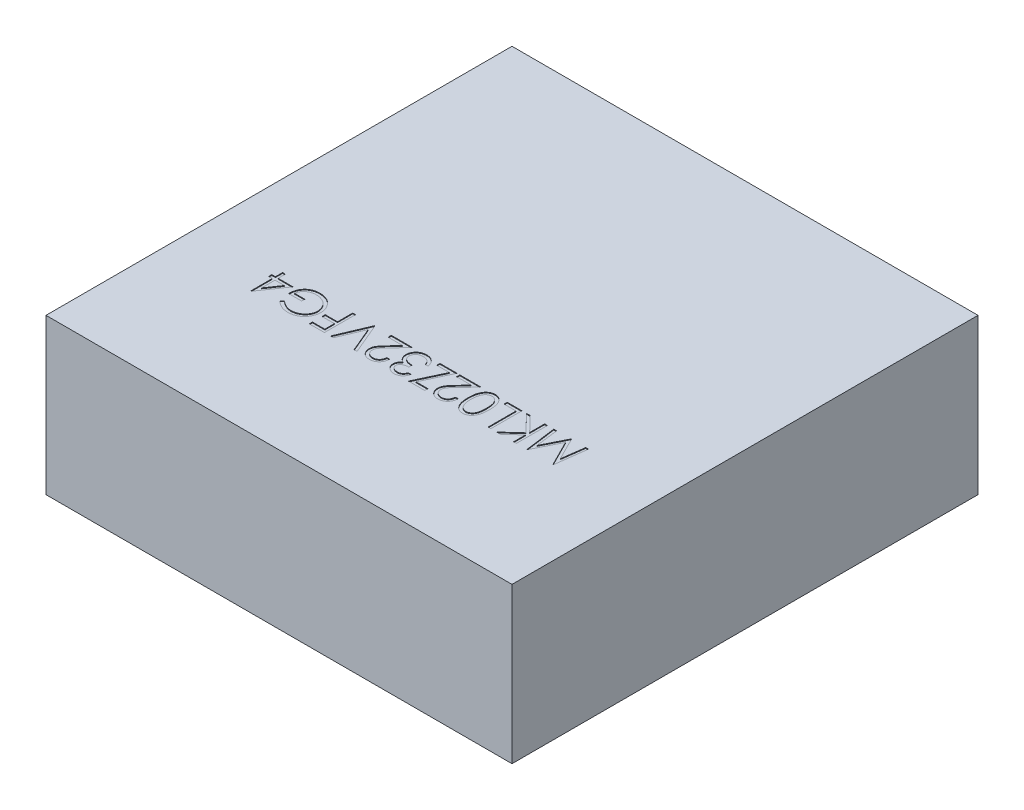
from build123d import *

# Parameters (mm, degrees)
BASES_W          = 3
BASES_H          = 3
BASE_DEPTH       = 1
PARTNUMBER_DEPTH = 0.005


with BuildPart() as part:
    # BaseS → Base (new body)
    with BuildSketch(Plane(origin=(0, 0, 0), x_dir=(1, 0, 0), z_dir=(0, 1, 0))):
        Rectangle(BASES_W, BASES_H)
    extrude(amount=BASE_DEPTH)

    # PartNumberS → PartNumber (cut)
    # profile 1 of 12: a face of its own
    with BuildSketch(Plane(origin=(0, 1, 0), x_dir=(1, 0, 0), z_dir=(0, 1, 0))):
        Polygon((0.992307692, -0.5), (0.965905449, -0.7), (0.963341346, -0.7), (0.880769231, -0.535897436), (0.798397436, -0.7), (0.795793269, -0.7), (0.769230769, -0.5), (0.787259615, -0.5), (0.806410256, -0.643910256), (0.878605769, -0.5), (0.882652244, -0.5), (0.955128205, -0.644230769), (0.974238782, -0.5), align=None)
    # profile 2 of 12: a face of its own
    with BuildSketch(Plane(origin=(0, 1, 0), x_dir=(1, 0, 0), z_dir=(0, 1, 0))):
        Polygon((0.728205128, -0.7), (0.71025641, -0.7), (0.71025641, -0.623838141), (0.626883013, -0.7), (0.601282051, -0.7), (0.699559295, -0.61025641), (0.593589744, -0.5), (0.617508013, -0.5), (0.71025641, -0.596514423), (0.71025641, -0.5), (0.728205128, -0.5), align=None)
    # profile 3 of 12: a face of its own
    with BuildSketch(Plane(origin=(0, 1, 0), x_dir=(1, 0, 0), z_dir=(0, 1, 0))):
        Polygon((0.564102564, -0.7), (0.546153846, -0.7), (0.546153846, -0.520512821), (0.469230769, -0.520512821), (0.469230769, -0.5), (0.564102564, -0.5), align=None)
    # profile 4 of 12: a face of its own
    with BuildSketch(Plane(origin=(0, 1, 0), x_dir=(1, 0, 0), z_dir=(0, 1, 0))):
        with BuildLine():
            add(Edge.make_bspline(
                [(0.453846154, -0.599919872), (0.45382741, -0.603125437), (0.453791, -0.609352293), (0.453385947, -0.618425701), (0.45271307, -0.626937718), (0.451790935, -0.63488875), (0.450668765, -0.642280851), (0.449170735, -0.649094264), (0.447467153, -0.655360534), (0.445492704, -0.661100057), (0.443264911, -0.666390288), (0.440839812, -0.671328601), (0.438122833, -0.675909097), (0.4352634, -0.680199264), (0.432161436, -0.684155927), (0.42882773, -0.687761304), (0.425291645, -0.691071266), (0.421536448, -0.694031384), (0.417597932, -0.696610732), (0.413592604, -0.698948853), (0.409406222, -0.700798371), (0.405142046, -0.702379922), (0.400765722, -0.703632724), (0.396275342, -0.704504146), (0.391666876, -0.705049326), (0.388556562, -0.705101663), (0.386979167, -0.705128205)],
                knots=[0, 0, 0, 0, 1.64625301, 3.197870201, 4.6634513, 6.030635694, 7.308242971, 8.501545196, 9.611429483, 10.641742253, 11.616230371, 12.55791849, 13.464870342, 14.34944951, 15.20427819, 16.044004467, 16.869007726, 17.689551165, 18.496129964, 19.285613293, 20.0683943, 20.843080271, 21.620342827, 22.403213977, 23.190190624, 24, 24, 24, 24], degree=3))
            add(Edge.make_bspline(
                [(0.386979167, -0.705128205), (0.385387797, -0.705106134), (0.38222153, -0.705062219), (0.377557236, -0.704444098), (0.372974186, -0.703646272), (0.368541914, -0.702366689), (0.364176614, -0.700835502), (0.359986842, -0.698815126), (0.355824678, -0.696617809), (0.351879203, -0.693937268), (0.348032533, -0.690974829), (0.344426682, -0.687611703), (0.340969474, -0.683940966), (0.337791486, -0.679880749), (0.334756515, -0.675493306), (0.331979772, -0.67074186), (0.329403504, -0.66563694), (0.326979285, -0.66020221), (0.32485937, -0.654292502), (0.322974596, -0.647944676), (0.321429704, -0.641101249), (0.320152106, -0.633800343), (0.319160447, -0.62600579), (0.318438734, -0.617733383), (0.318057372, -0.608977945), (0.317985566, -0.60299178), (0.317948718, -0.599919872)],
                knots=[0, 0, 0, 0, 0.810910589, 1.61342667, 2.396193133, 3.181089899, 3.963115317, 4.752255436, 5.550715454, 6.36105385, 7.181178335, 8.024612154, 8.872680183, 9.750181803, 10.651284446, 11.591556747, 12.554036451, 13.566402641, 14.62422919, 15.753422176, 16.94128843, 18.199818041, 19.531985927, 20.947085226, 22.433341622, 24, 24, 24, 24], degree=3))
            add(Edge.make_bspline(
                [(0.317948718, -0.599919872), (0.317986423, -0.596861401), (0.318060053, -0.590888756), (0.318430055, -0.582172145), (0.319179794, -0.573944878), (0.32009359, -0.566195034), (0.321411105, -0.558932745), (0.322877893, -0.552119008), (0.324748864, -0.545817847), (0.326818495, -0.539958796), (0.329208983, -0.534547089), (0.331765848, -0.529463239), (0.334584042, -0.524738759), (0.337560777, -0.520323507), (0.34079893, -0.516298111), (0.344209352, -0.512586312), (0.347850186, -0.509217343), (0.351716657, -0.506219926), (0.355699424, -0.503519192), (0.3598624, -0.501243526), (0.364108132, -0.49925961), (0.368480783, -0.497664773), (0.372952469, -0.496404048), (0.377539293, -0.495545817), (0.382222154, -0.494940871), (0.385388005, -0.4948949), (0.386979167, -0.494871795)],
                knots=[0, 0, 0, 0, 1.561431216, 3.049195289, 4.452146966, 5.778046447, 7.031138842, 8.218704273, 9.334037798, 10.384210803, 11.388620812, 12.352076869, 13.287433199, 14.19507451, 15.06813243, 15.922055533, 16.766344942, 17.596869952, 18.417486629, 19.220035357, 20.016159057, 20.807716045, 21.59340902, 22.384936649, 23.188266813, 24, 24, 24, 24], degree=3))
            add(Edge.make_bspline(
                [(0.386979167, -0.494871795), (0.388556507, -0.494898572), (0.391666713, -0.494951373), (0.396275972, -0.495493155), (0.400759842, -0.49637662), (0.405127285, -0.497576361), (0.409387239, -0.49910116), (0.413497978, -0.501040647), (0.417513774, -0.503290158), (0.421416363, -0.505849366), (0.425131138, -0.508782275), (0.428680244, -0.512025516), (0.431970786, -0.515662669), (0.435051357, -0.519635684), (0.437934516, -0.52393665), (0.440639989, -0.528552213), (0.443057704, -0.533538633), (0.445336009, -0.538857583), (0.447344353, -0.544639279), (0.449098001, -0.550927022), (0.450576487, -0.557763701), (0.451754121, -0.565149643), (0.452718866, -0.573073415), (0.453385284, -0.581547642), (0.453790797, -0.590554174), (0.453827365, -0.596741003), (0.453846154, -0.599919872)],
                knots=[0, 0, 0, 0, 0.810976328, 1.599087026, 2.383086309, 3.159618043, 3.926613167, 4.707144544, 5.494386734, 6.292609454, 7.104690378, 7.92621526, 8.762510248, 9.62398222, 10.509836085, 11.424023232, 12.373226806, 13.358118208, 14.398657954, 15.5185989, 16.713620699, 17.994156382, 19.364120462, 20.818119981, 22.365111093, 24, 24, 24, 24], degree=3))
        make_face()
        with BuildLine():
            add(Edge.make_bspline(
                [(0.435897436, -0.6), (0.435890461, -0.597328656), (0.435876923, -0.592144103), (0.4355335, -0.58462337), (0.43505549, -0.577596997), (0.434454125, -0.571067726), (0.433553497, -0.565058375), (0.432531677, -0.559543965), (0.431306074, -0.554534693), (0.42984879, -0.549986815), (0.428188889, -0.54583583), (0.426379449, -0.541971444), (0.424419435, -0.538346652), (0.422263877, -0.534974532), (0.419881894, -0.531873918), (0.417326651, -0.529030085), (0.414583291, -0.526454611), (0.410786486, -0.523398046), (0.40579838, -0.520202297), (0.399481442, -0.517453649), (0.392987642, -0.515715134), (0.388578797, -0.515494661), (0.386378205, -0.515384615)],
                knots=[0, 0, 0, 0, 1.459193451, 2.832007961, 4.111736495, 5.306635028, 6.412683014, 7.430020708, 8.369596877, 9.227877302, 10.036669781, 10.810175692, 11.557788084, 12.286326232, 12.994037279, 13.69140682, 14.37267704, 15.047194847, 16.352618509, 17.594157723, 18.799169539, 20, 20, 20, 20], degree=3))
            add(Edge.make_bspline(
                [(0.386378205, -0.515384615), (0.384164977, -0.51548111), (0.379746373, -0.515673757), (0.373256993, -0.517355101), (0.367009194, -0.520088434), (0.362078497, -0.523211202), (0.35833772, -0.526204156), (0.355656526, -0.528752995), (0.3531959, -0.531607774), (0.35086205, -0.53468769), (0.348721536, -0.538051844), (0.346775069, -0.541683988), (0.344998878, -0.545594227), (0.343986933, -0.548323927), (0.343469551, -0.549719551)],
                knots=[0, 0, 0, 0, 1.353621445, 2.702441307, 4.075953605, 5.516772412, 6.261413105, 7.007624062, 7.778524365, 8.566925914, 9.372323995, 10.217594641, 11.088702136, 12, 12, 12, 12], degree=3))
            add(Edge.make_bspline(
                [(0.343469551, -0.549719551), (0.342866593, -0.551504108), (0.341642329, -0.555127523), (0.340064514, -0.560748303), (0.33882192, -0.566645604), (0.337704013, -0.572784182), (0.336940981, -0.579209308), (0.33632682, -0.585901101), (0.335965067, -0.592864607), (0.335920224, -0.59759575), (0.335897436, -0.6)],
                knots=[0, 0, 0, 0, 0.884706709, 1.796334032, 2.740027952, 3.714592787, 4.726048262, 5.777819803, 6.87074269, 8, 8, 8, 8], degree=3))
            add(Edge.make_bspline(
                [(0.335897436, -0.6), (0.335922569, -0.602404198), (0.33597174, -0.607107906), (0.336294799, -0.613989435), (0.336813929, -0.620536826), (0.337516559, -0.626756019), (0.338481122, -0.632635944), (0.339639466, -0.638185014), (0.34099749, -0.643401737), (0.342555191, -0.648299556), (0.344310674, -0.6528609), (0.346250042, -0.657095587), (0.348319312, -0.661026458), (0.350568319, -0.664640869), (0.352965243, -0.66795991), (0.35559615, -0.67090718), (0.358293925, -0.673626053), (0.362130733, -0.676674111), (0.367112943, -0.679806494), (0.373355261, -0.682610687), (0.379815791, -0.684270285), (0.384192311, -0.684500434), (0.386378205, -0.684615385)],
                knots=[0, 0, 0, 0, 1.313528337, 2.569860077, 3.762944266, 4.901481389, 5.988248151, 7.017139294, 7.997571128, 8.932104357, 9.823695246, 10.66607014, 11.475539426, 12.248954257, 12.990316782, 13.708962568, 14.405488541, 15.08007697, 16.381737273, 17.610043218, 18.806313575, 20, 20, 20, 20], degree=3))
            add(Edge.make_bspline(
                [(0.386378205, -0.684615385), (0.388590668, -0.684500298), (0.393019624, -0.684269916), (0.399547738, -0.682616543), (0.405827425, -0.679826438), (0.410799137, -0.676670238), (0.41458193, -0.673637891), (0.417273833, -0.671049847), (0.419814287, -0.668232609), (0.42218486, -0.665146054), (0.424327265, -0.661780364), (0.426311102, -0.658181849), (0.428106105, -0.654323203), (0.429772272, -0.650174513), (0.431214094, -0.645619162), (0.43251046, -0.640610889), (0.43351106, -0.635060616), (0.434399504, -0.629023046), (0.435071067, -0.622486012), (0.435530168, -0.615443005), (0.435877966, -0.607896056), (0.435890816, -0.602684734), (0.435897436, -0.6)],
                knots=[0, 0, 0, 0, 1.207779899, 2.417760083, 3.652287919, 4.947299644, 5.621638849, 6.297435916, 6.984320042, 7.691843698, 8.42018894, 9.161205785, 9.934506883, 10.743085206, 11.601138371, 12.542248028, 13.566483018, 14.679455109, 15.87477181, 17.154161492, 18.533899613, 20, 20, 20, 20], degree=3))
        make_face(mode=Mode.SUBTRACT)
    # profile 5 of 12: a face of its own
    with BuildSketch(Plane(origin=(0, 1, 0), x_dir=(1, 0, 0), z_dir=(0, 1, 0))):
        with BuildLine():
            Line((0.274358974, -0.638461538), (0.292307692, -0.638461538))
            add(Edge.make_bspline(
                [(0.292307692, -0.638461538), (0.292190732, -0.640842744), (0.291961025, -0.645519368), (0.290884841, -0.652337711), (0.289346382, -0.658855729), (0.287166027, -0.665017542), (0.284473479, -0.670896759), (0.28117702, -0.67641531), (0.277346927, -0.681627966), (0.272990226, -0.686436034), (0.268262803, -0.69083121), (0.263192984, -0.694666834), (0.257832876, -0.697870482), (0.252228972, -0.700563223), (0.246316459, -0.702581997), (0.240151855, -0.704080553), (0.233707297, -0.70498201), (0.229316444, -0.705078919), (0.227083333, -0.705128205)],
                knots=[0, 0, 0, 0, 1.100776268, 2.161895295, 3.184016182, 4.190939212, 5.176500551, 6.166955529, 7.155448256, 8.160289653, 9.16017456, 10.133824356, 11.091467644, 12.04088621, 13.000931625, 13.972173743, 14.968683325, 16, 16, 16, 16], degree=3))
            add(Edge.make_bspline(
                [(0.227083333, -0.705128205), (0.224890146, -0.705077281), (0.220580612, -0.704977218), (0.214293537, -0.70410498), (0.20829416, -0.702768352), (0.202650471, -0.70078768), (0.197304551, -0.698302371), (0.192322591, -0.695211563), (0.187584121, -0.691661503), (0.183321698, -0.687474033), (0.179406148, -0.683005992), (0.176031181, -0.678234162), (0.173124632, -0.673299943), (0.170745713, -0.668164791), (0.168942387, -0.662811984), (0.167606295, -0.657292841), (0.166842513, -0.651543668), (0.166725935, -0.647651753), (0.166666667, -0.645673077)],
                knots=[0, 0, 0, 0, 1.111674182, 2.184400057, 3.212814286, 4.223731311, 5.211378316, 6.196328225, 7.191884489, 8.207283132, 9.220262353, 10.201199469, 11.166417575, 12.120932471, 13.06540007, 14.026332106, 14.996573967, 16, 16, 16, 16], degree=3))
            add(Edge.make_bspline(
                [(0.166666667, -0.645673077), (0.166763426, -0.642887488), (0.166955247, -0.637365192), (0.168596046, -0.629250039), (0.171158789, -0.621387625), (0.174244079, -0.615059564), (0.177357402, -0.60996099), (0.180160152, -0.605761003), (0.183459894, -0.601239937), (0.187228437, -0.596379492), (0.191530681, -0.591243319), (0.196254853, -0.585726628), (0.201522957, -0.579931426), (0.205217164, -0.575970646), (0.20713141, -0.573918269)],
                knots=[0, 0, 0, 0, 1.184416499, 2.348048165, 3.509039915, 4.696071444, 5.333504901, 6.05069495, 6.844171097, 7.714965912, 8.667477798, 9.695072654, 10.805644396, 12, 12, 12, 12], degree=3))
            Line((0.20713141, -0.573918269), (0.257171474, -0.520512821))
            Line((0.257171474, -0.520512821), (0.164102564, -0.520512821))
            Line((0.164102564, -0.520512821), (0.164102564, -0.5))
            Line((0.164102564, -0.5), (0.3, -0.5))
            Line((0.3, -0.5), (0.222435897, -0.582772436))
            add(Edge.make_bspline(
                [(0.222435897, -0.582772436), (0.220547313, -0.58474366), (0.216919729, -0.588529979), (0.211791055, -0.594059562), (0.207177272, -0.59918341), (0.203075318, -0.603924227), (0.19948182, -0.608255137), (0.196408274, -0.61221008), (0.193841096, -0.615755116), (0.191120422, -0.619919677), (0.188526079, -0.625010393), (0.186245917, -0.631200221), (0.184865538, -0.637586255), (0.184699103, -0.64190044), (0.184615385, -0.644070513)],
                knots=[0, 0, 0, 0, 1.329530082, 2.553755191, 3.672934919, 4.687409497, 5.60679272, 6.413407421, 7.126401618, 7.737995624, 8.834647426, 9.90044882, 10.943907757, 12, 12, 12, 12], degree=3))
            add(Edge.make_bspline(
                [(0.184615385, -0.644070513), (0.18465134, -0.645435315), (0.1847222, -0.648125078), (0.185359423, -0.6520661), (0.186295629, -0.655882416), (0.187738613, -0.65952684), (0.189472304, -0.66307105), (0.191687223, -0.666407291), (0.194218293, -0.669649288), (0.197154211, -0.672685875), (0.200377303, -0.67546786), (0.203782799, -0.677932041), (0.207385633, -0.679991432), (0.211170791, -0.681679628), (0.215127673, -0.683003937), (0.219263944, -0.68392157), (0.223568174, -0.684497712), (0.226507231, -0.684575664), (0.228004808, -0.684615385)],
                knots=[0, 0, 0, 0, 0.991504627, 1.954065223, 2.895985987, 3.842598665, 4.797835564, 5.759220273, 6.74786863, 7.784730864, 8.824135544, 9.839918996, 10.835834653, 11.835434876, 12.84861661, 13.863796685, 14.911511676, 16, 16, 16, 16], degree=3))
            add(Edge.make_bspline(
                [(0.228004808, -0.684615385), (0.229569255, -0.68457615), (0.232641571, -0.6844991), (0.237142717, -0.683915127), (0.241466718, -0.683030728), (0.245546942, -0.681622773), (0.249468781, -0.679974945), (0.253132187, -0.677841298), (0.256640069, -0.675403277), (0.259921901, -0.672560698), (0.26291094, -0.669351856), (0.265630096, -0.665859087), (0.267934063, -0.662020473), (0.269979272, -0.657928121), (0.271543453, -0.6534696), (0.272880716, -0.648753945), (0.273852084, -0.643713878), (0.274187205, -0.640241397), (0.274358974, -0.638461538)],
                knots=[0, 0, 0, 0, 1.031072318, 2.024855787, 2.988461151, 3.935103592, 4.865765533, 5.788564469, 6.724086513, 7.67908574, 8.64457978, 9.611397706, 10.591395687, 11.591555111, 12.622101007, 13.700900657, 14.821571223, 16, 16, 16, 16], degree=3))
        make_face()
    # profile 6 of 12: a face of its own
    with BuildSketch(Plane(origin=(0, 1, 0), x_dir=(1, 0, 0), z_dir=(0, 1, 0))):
        Polygon((0.138461538, -0.679487179), (0.138461538, -0.7), (0.033333333, -0.7), (0.117227564, -0.520512821), (0.035897436, -0.520512821), (0.035897436, -0.5), (0.146153846, -0.5), (0.062259615, -0.679487179), align=None)
    # profile 7 of 12: a face of its own
    with BuildSketch(Plane(origin=(0, 1, 0), x_dir=(1, 0, 0), z_dir=(0, 1, 0))):
        with BuildLine():
            Line((-0.012820513, -0.653846154), (0.005128205, -0.653846154))
            add(Edge.make_bspline(
                [(0.005128205, -0.653846154), (0.004641945, -0.655859439), (0.003691346, -0.659795246), (0.001708628, -0.665418518), (-0.000451329, -0.670739862), (-0.003044993, -0.675659638), (-0.005874064, -0.680276718), (-0.009115363, -0.684486382), (-0.012619347, -0.688395694), (-0.016495058, -0.691865022), (-0.020559553, -0.695006607), (-0.024870103, -0.697685181), (-0.029339982, -0.699989419), (-0.034000161, -0.701887718), (-0.038864514, -0.703317748), (-0.043889064, -0.704355279), (-0.049086978, -0.705029057), (-0.052615412, -0.705094815), (-0.054407051, -0.705128205)],
                knots=[0, 0, 0, 0, 1.162005537, 2.271625781, 3.343758855, 4.383309926, 5.390229558, 6.379919256, 7.361854164, 8.333198761, 9.295911338, 10.242430842, 11.177959212, 12.116337295, 13.062827104, 14.020064771, 14.994644689, 16, 16, 16, 16], degree=3))
            add(Edge.make_bspline(
                [(-0.054407051, -0.705128205), (-0.057017494, -0.705049392), (-0.062181437, -0.704893485), (-0.069767897, -0.703469803), (-0.077083715, -0.701216938), (-0.084048815, -0.698104154), (-0.09051844, -0.694264879), (-0.096274793, -0.689695465), (-0.101239851, -0.684484076), (-0.105405244, -0.67872793), (-0.108666673, -0.672576186), (-0.111071608, -0.666244749), (-0.112535704, -0.659748636), (-0.11272545, -0.655362506), (-0.112820513, -0.653165064)],
                knots=[0, 0, 0, 0, 1.083050992, 2.142477498, 3.193116406, 4.255571735, 5.30263384, 6.308962982, 7.297363603, 8.282367274, 9.249857812, 10.179914175, 11.08814088, 12, 12, 12, 12], degree=3))
            add(Edge.make_bspline(
                [(-0.112820513, -0.653165064), (-0.112754022, -0.65105039), (-0.112623909, -0.646912301), (-0.111519126, -0.640871073), (-0.109659911, -0.635177267), (-0.107084496, -0.629806915), (-0.103750693, -0.624794067), (-0.099712254, -0.620127445), (-0.094940673, -0.61578635), (-0.091324734, -0.613299523), (-0.089463141, -0.612019231)],
                knots=[0, 0, 0, 0, 1.024540389, 2.004866551, 2.965041327, 3.920577974, 4.882998113, 5.874504559, 6.905732034, 8, 8, 8, 8], degree=3))
            add(Edge.make_bspline(
                [(-0.089463141, -0.612019231), (-0.091593382, -0.610995631), (-0.095820845, -0.608964297), (-0.101524926, -0.604917242), (-0.106781982, -0.600359254), (-0.109679284, -0.596762548), (-0.111137821, -0.594951923)],
                knots=[0, 0, 0, 0, 1.015663554, 2.015584519, 3.001021554, 4, 4, 4, 4], degree=3))
            add(Edge.make_bspline(
                [(-0.111137821, -0.594951923), (-0.112100575, -0.593634478), (-0.114010317, -0.591021161), (-0.11636091, -0.586817028), (-0.118517738, -0.582580215), (-0.120105101, -0.578144135), (-0.121474932, -0.573651284), (-0.122376235, -0.569005451), (-0.122954836, -0.564250776), (-0.123036083, -0.561032679), (-0.123076923, -0.559415064)],
                knots=[0, 0, 0, 0, 1.02516404, 2.033540309, 3.025129118, 4.011046665, 4.991655828, 5.976607087, 6.982917762, 8, 8, 8, 8], degree=3))
            add(Edge.make_bspline(
                [(-0.123076923, -0.559415064), (-0.122974139, -0.556614634), (-0.122769054, -0.551026954), (-0.120943858, -0.54276937), (-0.118096783, -0.534712452), (-0.114128911, -0.526970463), (-0.109197448, -0.519748905), (-0.103362856, -0.513268976), (-0.096618923, -0.507749819), (-0.089162002, -0.503097513), (-0.081051919, -0.499410613), (-0.072412013, -0.496753903), (-0.06329344, -0.49516025), (-0.05705766, -0.494969041), (-0.053886218, -0.494871795)],
                knots=[0, 0, 0, 0, 0.955619592, 1.906742024, 2.874954321, 3.868585453, 4.869520953, 5.854611167, 6.836527075, 7.836578462, 8.849204403, 9.870874567, 10.917152508, 12, 12, 12, 12], degree=3))
            add(Edge.make_bspline(
                [(-0.053886218, -0.494871795), (-0.051748107, -0.49492184), (-0.047541017, -0.495020311), (-0.041353757, -0.495681497), (-0.035460244, -0.496921931), (-0.029803249, -0.498481947), (-0.024468149, -0.500638844), (-0.019378204, -0.503210266), (-0.014555726, -0.506262151), (-0.010029353, -0.509799634), (-0.005803921, -0.513759317), (-0.001987081, -0.518206982), (0.001463397, -0.523059619), (0.00452559, -0.52836088), (0.007212384, -0.534095915), (0.00946596, -0.540287707), (0.01143361, -0.546888254), (0.012350224, -0.551486777), (0.012820513, -0.553846154)],
                knots=[0, 0, 0, 0, 1.048603596, 2.063302207, 3.045874044, 3.999447474, 4.937100059, 5.862643889, 6.7929026, 7.7308982, 8.676022965, 9.627908155, 10.600123445, 11.591992905, 12.626222643, 13.701663232, 14.820785756, 16, 16, 16, 16], degree=3))
            Line((0.012820513, -0.553846154), (-0.005128205, -0.553846154))
            add(Edge.make_bspline(
                [(-0.005128205, -0.553846154), (-0.005595822, -0.55230621), (-0.006505377, -0.549310886), (-0.008053622, -0.545000012), (-0.009817524, -0.541048123), (-0.011709784, -0.53742623), (-0.013697124, -0.534098664), (-0.015920834, -0.531153415), (-0.018216214, -0.528461117), (-0.019946462, -0.526944282), (-0.020793269, -0.526201923)],
                knots=[0, 0, 0, 0, 1.198163088, 2.33053128, 3.407730985, 4.417276592, 5.372219308, 6.28897303, 7.162600585, 8, 8, 8, 8], degree=3))
            add(Edge.make_bspline(
                [(-0.020793269, -0.526201923), (-0.021913199, -0.525338946), (-0.024149601, -0.523615655), (-0.027791622, -0.521410219), (-0.031635315, -0.519522419), (-0.035712732, -0.517987935), (-0.04002442, -0.516836097), (-0.044552889, -0.516007058), (-0.04930557, -0.515459763), (-0.052549182, -0.51541003), (-0.054206731, -0.515384615)],
                knots=[0, 0, 0, 0, 0.946083416, 1.889246487, 2.84504177, 3.809995578, 4.801312957, 5.829064617, 6.89060985, 8, 8, 8, 8], degree=3))
            add(Edge.make_bspline(
                [(-0.054206731, -0.515384615), (-0.056078385, -0.515419753), (-0.059738243, -0.515488461), (-0.065078166, -0.516122158), (-0.070159857, -0.517041039), (-0.074931455, -0.518478347), (-0.079457891, -0.520202635), (-0.083638121, -0.522460045), (-0.08759504, -0.525009425), (-0.091212727, -0.527974844), (-0.094474249, -0.531180141), (-0.097292565, -0.534580675), (-0.099733548, -0.538071008), (-0.101695691, -0.541732562), (-0.103247839, -0.545529421), (-0.104303838, -0.549475795), (-0.105038259, -0.553538455), (-0.105098059, -0.556300116), (-0.105128205, -0.557692308)],
                knots=[0, 0, 0, 0, 1.216990249, 2.379719373, 3.493992396, 4.571561497, 5.616923107, 6.638958652, 7.655775068, 8.674704564, 9.676001865, 10.625896028, 11.54399481, 12.441854662, 13.322657739, 14.20572845, 15.095482574, 16, 16, 16, 16], degree=3))
            add(Edge.make_bspline(
                [(-0.105128205, -0.557692308), (-0.105040577, -0.559555696), (-0.104865756, -0.5632732), (-0.10353657, -0.568744529), (-0.101330697, -0.574018171), (-0.098302612, -0.579025064), (-0.094528157, -0.583611196), (-0.09018575, -0.58771628), (-0.085182738, -0.591134393), (-0.0805519, -0.593489428), (-0.076439391, -0.595058495), (-0.0729271, -0.596158774), (-0.068991468, -0.597038296), (-0.064679786, -0.597889066), (-0.059973855, -0.598602295), (-0.05486944, -0.599199653), (-0.049364486, -0.599676883), (-0.04555357, -0.599890117), (-0.043589744, -0.6)],
                knots=[0, 0, 0, 0, 1.070440979, 2.135555593, 3.216243406, 4.345886539, 5.486149072, 6.621334998, 7.769144672, 8.957074012, 9.598644492, 10.297969361, 11.070758978, 11.915404831, 12.824182859, 13.805940418, 14.869366021, 16, 16, 16, 16], degree=3))
            Line((-0.043589744, -0.6), (-0.043589744, -0.620512821))
            add(Edge.make_bspline(
                [(-0.043589744, -0.620512821), (-0.046063134, -0.620561043), (-0.050906203, -0.620655467), (-0.058000575, -0.62156233), (-0.064763729, -0.623034295), (-0.071093937, -0.625089351), (-0.076833851, -0.627591218), (-0.081861201, -0.630392354), (-0.085995127, -0.633623909), (-0.089309668, -0.637133123), (-0.0917681, -0.640920736), (-0.093582769, -0.644850479), (-0.094656107, -0.648995461), (-0.094799646, -0.651823627), (-0.094871795, -0.653245192)],
                knots=[0, 0, 0, 0, 1.321816535, 2.58820849, 3.816448615, 5.017641336, 6.139869627, 7.160068286, 8.085608132, 8.934319198, 9.728416342, 10.48890201, 11.240453369, 12, 12, 12, 12], degree=3))
            add(Edge.make_bspline(
                [(-0.094871795, -0.653245192), (-0.094848635, -0.654289811), (-0.09480256, -0.656368031), (-0.094198289, -0.659413745), (-0.093332212, -0.662366392), (-0.092073978, -0.665191473), (-0.090446698, -0.667897968), (-0.088477933, -0.670495763), (-0.086162694, -0.673009663), (-0.083516016, -0.675384225), (-0.080562255, -0.677521373), (-0.077419965, -0.679426611), (-0.074076894, -0.681028645), (-0.070554829, -0.682356622), (-0.06683473, -0.683353822), (-0.062936169, -0.684070288), (-0.058851131, -0.684518117), (-0.056064178, -0.684582603), (-0.054647436, -0.684615385)],
                knots=[0, 0, 0, 0, 0.884246871, 1.759167212, 2.622361933, 3.489113179, 4.372562419, 5.294145153, 6.247651513, 7.265905295, 8.30305477, 9.334068495, 10.37719476, 11.441246459, 12.52060732, 13.637552802, 14.799054011, 16, 16, 16, 16], degree=3))
            add(Edge.make_bspline(
                [(-0.054647436, -0.684615385), (-0.052370122, -0.684536032), (-0.047922, -0.684381039), (-0.041510767, -0.683018718), (-0.035556811, -0.680860261), (-0.031021098, -0.678253931), (-0.027666084, -0.67569), (-0.025222657, -0.67348425), (-0.022866943, -0.670983381), (-0.020691383, -0.668118798), (-0.018565612, -0.664989002), (-0.016509928, -0.661576754), (-0.014590359, -0.657833407), (-0.013421887, -0.655200978), (-0.012820513, -0.653846154)],
                knots=[0, 0, 0, 0, 1.4727372, 2.876598283, 4.222346151, 5.558423782, 6.24313385, 6.953189256, 7.68715613, 8.463578749, 9.278833271, 10.135787152, 11.040551781, 12, 12, 12, 12], degree=3))
        make_face()
    # profile 8 of 12: a face of its own
    with BuildSketch(Plane(origin=(0, 1, 0), x_dir=(1, 0, 0), z_dir=(0, 1, 0))):
        with BuildLine():
            Line((-0.166666667, -0.638461538), (-0.148717949, -0.638461538))
            add(Edge.make_bspline(
                [(-0.148717949, -0.638461538), (-0.148834909, -0.640842744), (-0.149064616, -0.645519368), (-0.1501408, -0.652337711), (-0.151679259, -0.658855729), (-0.153859614, -0.665017542), (-0.156552162, -0.670896759), (-0.159848621, -0.67641531), (-0.163678714, -0.681627966), (-0.168035415, -0.686436034), (-0.172762838, -0.69083121), (-0.177832657, -0.694666834), (-0.183192765, -0.697870482), (-0.18879667, -0.700563223), (-0.194709182, -0.702581997), (-0.200873786, -0.704080553), (-0.207318344, -0.70498201), (-0.211709197, -0.705078919), (-0.213942308, -0.705128205)],
                knots=[0, 0, 0, 0, 1.100776268, 2.161895295, 3.184016182, 4.190939212, 5.176500551, 6.166955529, 7.155448256, 8.160289653, 9.16017456, 10.133824356, 11.091467644, 12.04088621, 13.000931625, 13.972173743, 14.968683325, 16, 16, 16, 16], degree=3))
            add(Edge.make_bspline(
                [(-0.213942308, -0.705128205), (-0.216135495, -0.705077281), (-0.220445029, -0.704977218), (-0.226732104, -0.70410498), (-0.232731481, -0.702768352), (-0.23837517, -0.70078768), (-0.24372109, -0.698302371), (-0.24870305, -0.695211563), (-0.25344152, -0.691661503), (-0.257703943, -0.687474033), (-0.261619493, -0.683005992), (-0.26499446, -0.678234162), (-0.267901009, -0.673299943), (-0.270279928, -0.668164791), (-0.272083254, -0.662811984), (-0.273419346, -0.657292841), (-0.274183128, -0.651543668), (-0.274299706, -0.647651753), (-0.274358974, -0.645673077)],
                knots=[0, 0, 0, 0, 1.111674182, 2.184400057, 3.212814286, 4.223731311, 5.211378316, 6.196328225, 7.191884489, 8.207283132, 9.220262353, 10.201199469, 11.166417575, 12.120932471, 13.06540007, 14.026332106, 14.996573967, 16, 16, 16, 16], degree=3))
            add(Edge.make_bspline(
                [(-0.274358974, -0.645673077), (-0.274262215, -0.642887488), (-0.274070394, -0.637365192), (-0.272429595, -0.629250039), (-0.269866852, -0.621387625), (-0.266781563, -0.615059564), (-0.263668239, -0.60996099), (-0.260865489, -0.605761003), (-0.257565747, -0.601239937), (-0.253797204, -0.596379492), (-0.24949496, -0.591243319), (-0.244770788, -0.585726628), (-0.239502684, -0.579931426), (-0.235808477, -0.575970646), (-0.233894231, -0.573918269)],
                knots=[0, 0, 0, 0, 1.184416499, 2.348048165, 3.509039915, 4.696071444, 5.333504901, 6.05069495, 6.844171097, 7.714965912, 8.667477798, 9.695072654, 10.805644396, 12, 12, 12, 12], degree=3))
            Line((-0.233894231, -0.573918269), (-0.183854167, -0.520512821))
            Line((-0.183854167, -0.520512821), (-0.276923077, -0.520512821))
            Line((-0.276923077, -0.520512821), (-0.276923077, -0.5))
            Line((-0.276923077, -0.5), (-0.141025641, -0.5))
            Line((-0.141025641, -0.5), (-0.218589744, -0.582772436))
            add(Edge.make_bspline(
                [(-0.218589744, -0.582772436), (-0.220478328, -0.58474366), (-0.224105912, -0.588529979), (-0.229234586, -0.594059562), (-0.233848369, -0.59918341), (-0.237950323, -0.603924227), (-0.241543821, -0.608255137), (-0.244617367, -0.61221008), (-0.247184545, -0.615755116), (-0.249905219, -0.619919677), (-0.252499562, -0.625010393), (-0.254779724, -0.631200221), (-0.256160103, -0.637586255), (-0.256326538, -0.64190044), (-0.256410256, -0.644070513)],
                knots=[0, 0, 0, 0, 1.329530082, 2.553755191, 3.672934919, 4.687409497, 5.60679272, 6.413407421, 7.126401618, 7.737995624, 8.834647426, 9.90044882, 10.943907757, 12, 12, 12, 12], degree=3))
            add(Edge.make_bspline(
                [(-0.256410256, -0.644070513), (-0.256374301, -0.645435315), (-0.256303441, -0.648125078), (-0.255666218, -0.6520661), (-0.254730012, -0.655882416), (-0.253287029, -0.65952684), (-0.251553337, -0.66307105), (-0.249338418, -0.666407291), (-0.246807348, -0.669649288), (-0.24387143, -0.672685875), (-0.240648338, -0.67546786), (-0.237242842, -0.677932041), (-0.233640008, -0.679991432), (-0.22985485, -0.681679628), (-0.225897968, -0.683003937), (-0.221761697, -0.68392157), (-0.217457467, -0.684497712), (-0.21451841, -0.684575664), (-0.213020833, -0.684615385)],
                knots=[0, 0, 0, 0, 0.991504627, 1.954065223, 2.895985987, 3.842598665, 4.797835564, 5.759220273, 6.74786863, 7.784730864, 8.824135544, 9.839918996, 10.835834653, 11.835434876, 12.84861661, 13.863796685, 14.911511676, 16, 16, 16, 16], degree=3))
            add(Edge.make_bspline(
                [(-0.213020833, -0.684615385), (-0.211456386, -0.68457615), (-0.20838407, -0.6844991), (-0.203882924, -0.683915127), (-0.199558923, -0.683030728), (-0.195478699, -0.681622773), (-0.19155686, -0.679974945), (-0.187893454, -0.677841298), (-0.184385572, -0.675403277), (-0.18110374, -0.672560698), (-0.178114701, -0.669351856), (-0.175395545, -0.665859087), (-0.173091578, -0.662020473), (-0.171046369, -0.657928121), (-0.169482188, -0.6534696), (-0.168144925, -0.648753945), (-0.167173557, -0.643713878), (-0.166838437, -0.640241397), (-0.166666667, -0.638461538)],
                knots=[0, 0, 0, 0, 1.031072318, 2.024855787, 2.988461151, 3.935103592, 4.865765533, 5.788564469, 6.724086513, 7.67908574, 8.64457978, 9.611397706, 10.591395687, 11.591555111, 12.622101007, 13.700900657, 14.821571223, 16, 16, 16, 16], degree=3))
        make_face()
    # profile 9 of 12: a face of its own
    with BuildSketch(Plane(origin=(0, 1, 0), x_dir=(1, 0, 0), z_dir=(0, 1, 0))):
        Polygon((-0.297435897, -0.7), (-0.316666667, -0.7), (-0.383333333, -0.542387821), (-0.45, -0.7), (-0.469230769, -0.7), (-0.384615385, -0.5), (-0.382051282, -0.5), align=None)
    # profile 10 of 12: a face of its own
    with BuildSketch(Plane(origin=(0, 1, 0), x_dir=(1, 0, 0), z_dir=(0, 1, 0))):
        Polygon((-0.507692308, -0.7), (-0.605128205, -0.7), (-0.605128205, -0.679487179), (-0.525641026, -0.679487179), (-0.525641026, -0.617948718), (-0.605128205, -0.617948718), (-0.605128205, -0.597435897), (-0.525641026, -0.597435897), (-0.525641026, -0.5), (-0.507692308, -0.5), align=None)
    # profile 11 of 12: a face of its own
    with BuildSketch(Plane(origin=(0, 1, 0), x_dir=(1, 0, 0), z_dir=(0, 1, 0))):
        with BuildLine():
            Line((-0.828205128, -0.665865385), (-0.812820513, -0.651282051))
            add(Edge.make_bspline(
                [(-0.812820513, -0.651282051), (-0.810020275, -0.653897361), (-0.804501438, -0.659051734), (-0.795546874, -0.665814039), (-0.786191253, -0.671561805), (-0.776510638, -0.676284033), (-0.766691706, -0.679954787), (-0.756930493, -0.682608935), (-0.747295434, -0.684315877), (-0.740898825, -0.684516382), (-0.737740385, -0.684615385)],
                knots=[0, 0, 0, 0, 1.091957225, 2.152079168, 3.193085318, 4.218301889, 5.218403563, 6.17723952, 7.099979378, 8, 8, 8, 8], degree=3))
            add(Edge.make_bspline(
                [(-0.737740385, -0.684615385), (-0.735802413, -0.684591715), (-0.731931495, -0.684544437), (-0.726181508, -0.68394243), (-0.720492593, -0.683073917), (-0.71488437, -0.681830197), (-0.70933454, -0.680214815), (-0.703855449, -0.678264482), (-0.698457673, -0.675916697), (-0.693169607, -0.673240008), (-0.688016869, -0.670317961), (-0.683170691, -0.667059014), (-0.678610865, -0.663563454), (-0.674369635, -0.659785436), (-0.670388906, -0.655787843), (-0.666741547, -0.651513873), (-0.663347796, -0.647026785), (-0.660334591, -0.642262259), (-0.657611098, -0.637355671), (-0.655252785, -0.632346134), (-0.65322214, -0.627268979), (-0.651599532, -0.622121344), (-0.650295017, -0.616906515), (-0.649371664, -0.61163264), (-0.648853041, -0.606273736), (-0.648763142, -0.602685345), (-0.648717949, -0.60088141)],
                knots=[0, 0, 0, 0, 1.028307134, 2.053947307, 3.065600992, 4.082111276, 5.100671203, 6.132125737, 7.167228006, 8.222953114, 9.277225349, 10.309459149, 11.320441984, 12.324791754, 13.322338422, 14.312705492, 15.305176196, 16.306142747, 17.302479595, 18.282363326, 19.243345101, 20.20291386, 21.145121196, 22.094978082, 23.042318507, 24, 24, 24, 24], degree=3))
            add(Edge.make_bspline(
                [(-0.648717949, -0.60088141), (-0.648761546, -0.599037476), (-0.64884862, -0.595354642), (-0.649394472, -0.589856161), (-0.65044167, -0.584450551), (-0.65172081, -0.579086816), (-0.653531397, -0.573833418), (-0.655636148, -0.568613422), (-0.658174006, -0.563475342), (-0.661096406, -0.558454992), (-0.664325972, -0.553569413), (-0.667877347, -0.548928661), (-0.671757239, -0.544586973), (-0.675894313, -0.540480871), (-0.680326315, -0.536636284), (-0.68509623, -0.53309955), (-0.690137293, -0.52981598), (-0.695451738, -0.526821646), (-0.700983394, -0.524146939), (-0.70665519, -0.521768413), (-0.712485356, -0.519809599), (-0.718443222, -0.518213134), (-0.724521695, -0.516904546), (-0.730751627, -0.51606269), (-0.73708721, -0.515451785), (-0.741357989, -0.515407119), (-0.743509615, -0.515384615)],
                knots=[0, 0, 0, 0, 0.935896426, 1.86923723, 2.799743935, 3.728471844, 4.66505513, 5.616527375, 6.583419551, 7.570341864, 8.562833498, 9.553750335, 10.533080376, 11.5155245, 12.510142773, 13.507781369, 14.526649666, 15.561487327, 16.601173999, 17.643331812, 18.680652164, 19.71969803, 20.772446191, 21.833473655, 22.9085001, 24, 24, 24, 24], degree=3))
            add(Edge.make_bspline(
                [(-0.743509615, -0.515384615), (-0.746102674, -0.515438797), (-0.751194567, -0.515545192), (-0.758679357, -0.516374099), (-0.76586865, -0.51766704), (-0.772739038, -0.519566416), (-0.779315468, -0.521970551), (-0.785573641, -0.524943629), (-0.791530996, -0.52845427), (-0.797161156, -0.532431751), (-0.802332451, -0.53686225), (-0.807032866, -0.541604398), (-0.811124662, -0.546696032), (-0.814634526, -0.552136044), (-0.817655509, -0.557844333), (-0.820065306, -0.563918737), (-0.821929169, -0.570291408), (-0.822691652, -0.574697001), (-0.823076923, -0.576923077)],
                knots=[0, 0, 0, 0, 1.130234505, 2.219399076, 3.279128566, 4.311639422, 5.322903917, 6.328167287, 7.327698761, 8.334124803, 9.329374007, 10.292761544, 11.24113083, 12.171311216, 13.111441694, 14.052040787, 15.015727358, 16, 16, 16, 16], degree=3))
            Line((-0.823076923, -0.576923077), (-0.756410256, -0.576923077))
            Line((-0.756410256, -0.576923077), (-0.756410256, -0.597435897))
            Line((-0.756410256, -0.597435897), (-0.841025641, -0.597435897))
            add(Edge.make_bspline(
                [(-0.841025641, -0.597435897), (-0.840928164, -0.593612612), (-0.840737384, -0.586129753), (-0.83939916, -0.575217166), (-0.837238216, -0.564910212), (-0.834286199, -0.555198036), (-0.830464754, -0.546094403), (-0.825814895, -0.537590067), (-0.820262203, -0.529739971), (-0.814004463, -0.522480028), (-0.806981608, -0.516004073), (-0.799383402, -0.510312305), (-0.791197289, -0.50551787), (-0.782431014, -0.501617261), (-0.773113275, -0.498573033), (-0.763222511, -0.496414657), (-0.752772134, -0.495121516), (-0.745610038, -0.494956294), (-0.741947115, -0.494871795)],
                knots=[0, 0, 0, 0, 1.140356446, 2.231883559, 3.274166699, 4.278491846, 5.25512956, 6.21435461, 7.1637429, 8.11826594, 9.068280886, 10.0076534, 10.945064095, 11.891975133, 12.864533718, 13.863980011, 14.907571808, 16, 16, 16, 16], degree=3))
            add(Edge.make_bspline(
                [(-0.741947115, -0.494871795), (-0.739689393, -0.494904316), (-0.735236438, -0.494968458), (-0.728659813, -0.495424307), (-0.722264521, -0.496126054), (-0.716051492, -0.497185775), (-0.709997872, -0.498483756), (-0.704133896, -0.500145854), (-0.698437225, -0.50206978), (-0.692899054, -0.504258104), (-0.687569652, -0.506793627), (-0.682425279, -0.509611321), (-0.677437501, -0.512696656), (-0.672640291, -0.51610299), (-0.668008656, -0.519804844), (-0.663572459, -0.52380964), (-0.659306866, -0.528105132), (-0.656634839, -0.531155361), (-0.655288462, -0.532692308)],
                knots=[0, 0, 0, 0, 1.107784379, 2.184907829, 3.233506516, 4.263428166, 5.276301166, 6.270063455, 7.25232949, 8.225834625, 9.190232166, 10.146266622, 11.1027726, 12.066435141, 13.031522626, 14.010570082, 14.99756817, 16, 16, 16, 16], degree=3))
            add(Edge.make_bspline(
                [(-0.655288462, -0.532692308), (-0.65333498, -0.535130631), (-0.649460442, -0.539966803), (-0.644473119, -0.547715371), (-0.64022161, -0.555738335), (-0.63677202, -0.564058028), (-0.634078415, -0.572666669), (-0.632146629, -0.581553257), (-0.631014784, -0.590729236), (-0.630851725, -0.596938679), (-0.630769231, -0.600080128)],
                knots=[0, 0, 0, 0, 1.023165419, 2.029347347, 3.013907458, 3.994755782, 4.975994455, 5.96558838, 6.970761222, 8, 8, 8, 8], degree=3))
            add(Edge.make_bspline(
                [(-0.630769231, -0.600080128), (-0.630799727, -0.602432461), (-0.630860331, -0.607107229), (-0.631592006, -0.614048011), (-0.63264805, -0.620863832), (-0.63417769, -0.627561004), (-0.636190312, -0.634109795), (-0.638607394, -0.640560525), (-0.641438484, -0.64688741), (-0.644742263, -0.653034374), (-0.648338388, -0.658999315), (-0.652382174, -0.664594485), (-0.656648981, -0.669928071), (-0.661343228, -0.67484907), (-0.666289009, -0.679514686), (-0.671609344, -0.68380195), (-0.677216946, -0.687783194), (-0.683157094, -0.691380513), (-0.689335565, -0.694612979), (-0.695739061, -0.697446579), (-0.702365221, -0.699788502), (-0.70916451, -0.70177557), (-0.716188366, -0.703245008), (-0.723385826, -0.70431065), (-0.730794403, -0.705039827), (-0.735802177, -0.70509847), (-0.738341346, -0.705128205)],
                knots=[0, 0, 0, 0, 1.009025537, 2.005226976, 2.991671811, 3.967589759, 4.950148279, 5.929425679, 6.922109907, 7.921964004, 8.922507644, 9.908469609, 10.882248289, 11.851158214, 12.824245259, 13.798023939, 14.780666017, 15.773333703, 16.775582742, 17.771174102, 18.775387309, 19.789283316, 20.80873549, 21.851817535, 22.910773411, 24, 24, 24, 24], degree=3))
            add(Edge.make_bspline(
                [(-0.738341346, -0.705128205), (-0.740412118, -0.705095174), (-0.744518215, -0.705029677), (-0.750628036, -0.704573344), (-0.756631389, -0.703858075), (-0.76255839, -0.702857891), (-0.768386473, -0.70153481), (-0.774133293, -0.699922357), (-0.779787982, -0.698055448), (-0.785343812, -0.695827193), (-0.790838558, -0.693298502), (-0.796302658, -0.690451996), (-0.801717473, -0.687239146), (-0.807092386, -0.68365037), (-0.812461292, -0.679747318), (-0.817739272, -0.675418357), (-0.823053726, -0.670834199), (-0.826470972, -0.667538075), (-0.828205128, -0.665865385)],
                knots=[0, 0, 0, 0, 0.985875312, 1.954874891, 2.915472732, 3.863573565, 4.815313299, 5.759461513, 6.704487138, 7.649063459, 8.607849844, 9.583336382, 10.581114205, 11.603942397, 12.659508253, 13.739925933, 14.853076422, 16, 16, 16, 16], degree=3))
        make_face()
    # profile 12 of 12: a face of its own
    with BuildSketch(Plane(origin=(0, 1, 0), x_dir=(1, 0, 0), z_dir=(0, 1, 0))):
        Polygon((-0.973277244, -0.705128205), (-0.976923077, -0.705128205), (-0.976923077, -0.566666667), (-1, -0.566666667), (-1, -0.546153846), (-0.976923077, -0.546153846), (-0.976923077, -0.5), (-0.958974359, -0.5), (-0.958974359, -0.546153846), (-0.864102564, -0.546153846), align=None)
        Polygon((-0.958974359, -0.566666667), (-0.958974359, -0.653525641), (-0.899358974, -0.566666667), align=None, mode=Mode.SUBTRACT)
    extrude(amount=-PARTNUMBER_DEPTH, mode=Mode.SUBTRACT)


solid = part.part
